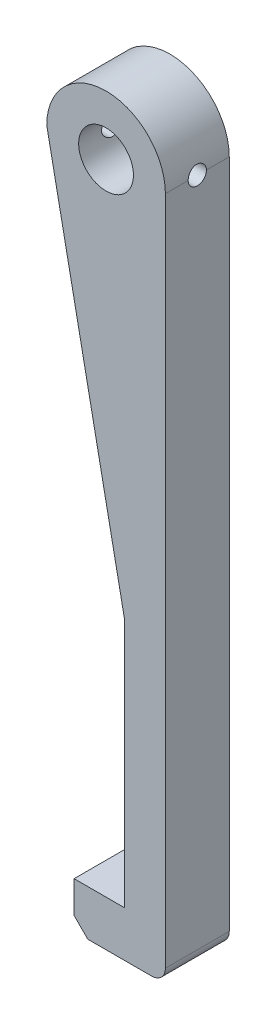
from build123d import *

# Parameters (mm, degrees)
SKETCH1_R           = 6
BOSS_EXTRUDE1_DEPTH = 14
SKETCH2_R           = 2
CUT_EXTRUDE1_DEPTH  = 93.822411087
FILLET1_R           = 3


with BuildPart() as part:
    # Sketch1 → Boss-Extrude1 (new body)
    with BuildSketch(Plane.XY):
        with BuildLine():
            Line((0, -65), (-11, -65))
            Line((-11, -65), (-11, -72))
            Line((-11, -72), (-8, -75))
            Line((-8, -75), (9, -75))
            Line((9, -75), (9, 75))
            ThreePointArc((9, 75), (-4, 88), (-17, 75))
            Line((-17, 75), (0, -10))
            Line((0, -10), (0, -65))
        make_face()
        with Locations((-4, 75)):
            Circle(SKETCH1_R, mode=Mode.SUBTRACT)
    extrude(amount=BOSS_EXTRUDE1_DEPTH)

    # Sketch2 → Cut-Extrude1 (cut, through all)
    with BuildSketch(Plane(origin=(9, 0, 0), x_dir=(0, 0, -1), z_dir=(1, 0, 0))):
        with Locations((-7, 75)):
            Circle(SKETCH2_R)
    extrude(amount=-CUT_EXTRUDE1_DEPTH, mode=Mode.SUBTRACT)

    # Fillet1
    fillet1_edges = [part.edges().sort_by_distance(p)[0] for p in [
        (9, -75, 7),
    ]]
    fillet(fillet1_edges, radius=FILLET1_R)


solid = part.part
